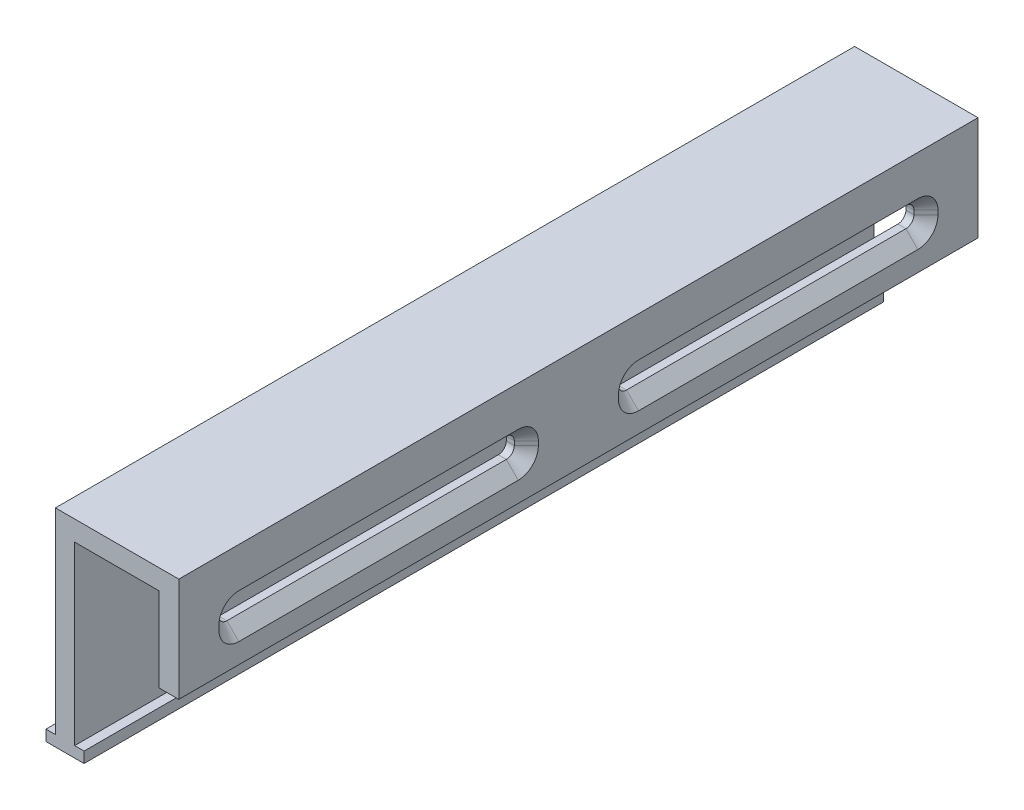
from build123d import *

# Parameters (mm, degrees)
BOSS_EXTRUDE1_DEPTH = 199.5
CUT_EXTRUDE1_DEPTH  = 5
CHAMFER1_SIZE       = 3


with BuildPart() as part:
    # Sketch1 → Boss-Extrude1 (new body)
    with BuildSketch(Plane.XY):
        Polygon((0, 0), (0, 49), (30.8, 49), (30.8, 23), (25.8, 23), (25.8, 44), (4.8, 44), (4.8, 0), (7.15, 0), (7.15, -2.7), (-2.35, -2.7), (-2.35, 0), align=None)
    extrude(amount=-BOSS_EXTRUDE1_DEPTH)

    # Sketch2 → Cut-Extrude1 (cut)
    with BuildSketch(Plane(origin=(30.8, 0, 0), x_dir=(0, 0, -1), z_dir=(1, 0, 0))):
        with BuildLine():
            Line((15, 36), (84.75, 36))
            ThreePointArc((84.75, 36), (86.164213562, 35.414213562), (86.75, 34))
            Line((86.75, 34), (86.75, 33))
            ThreePointArc((86.75, 33), (86.164213562, 31.585786438), (84.75, 31))
            Line((84.75, 31), (15, 31))
            ThreePointArc((15, 31), (13.585786438, 31.585786438), (13, 33))
            Line((13, 33), (13, 34))
            ThreePointArc((13, 34), (13.585786438, 35.414213562), (15, 36))
        make_face()
        with BuildLine():
            Line((114.75, 36), (184.5, 36))
            ThreePointArc((184.5, 36), (185.914213562, 35.414213562), (186.5, 34))
            Line((186.5, 34), (186.5, 33))
            ThreePointArc((186.5, 33), (185.914213562, 31.585786438), (184.5, 31))
            Line((184.5, 31), (114.75, 31))
            ThreePointArc((114.75, 31), (113.335786438, 31.585786438), (112.75, 33))
            Line((112.75, 33), (112.75, 34))
            ThreePointArc((112.75, 34), (113.335786438, 35.414213562), (114.75, 36))
        make_face()
    extrude(amount=-CUT_EXTRUDE1_DEPTH, mode=Mode.SUBTRACT)

    # Chamfer1
    chamfer1_edges = [part.edges().sort_by_distance(p)[0] for p in [
        (30.8, 31.585786438, -185.914213562),
        (30.8, 33.5, -186.5),
        (30.8, 35.414213562, -185.914213562),
        (30.8, 36, -149.625),
        (30.8, 35.414213562, -113.335786438),
        (30.8, 33.5, -112.75),
        (30.8, 31.585786438, -113.335786438),
        (30.8, 31, -149.625),
        (30.8, 31.585786438, -86.164213562),
        (30.8, 33.5, -86.75),
        (30.8, 35.414213562, -86.164213562),
        (30.8, 36, -49.875),
        (30.8, 35.414213562, -13.585786438),
        (30.8, 33.5, -13),
        (30.8, 31.585786438, -13.585786438),
        (30.8, 31, -49.875),
    ]]
    chamfer(chamfer1_edges, length=CHAMFER1_SIZE)


solid = part.part
